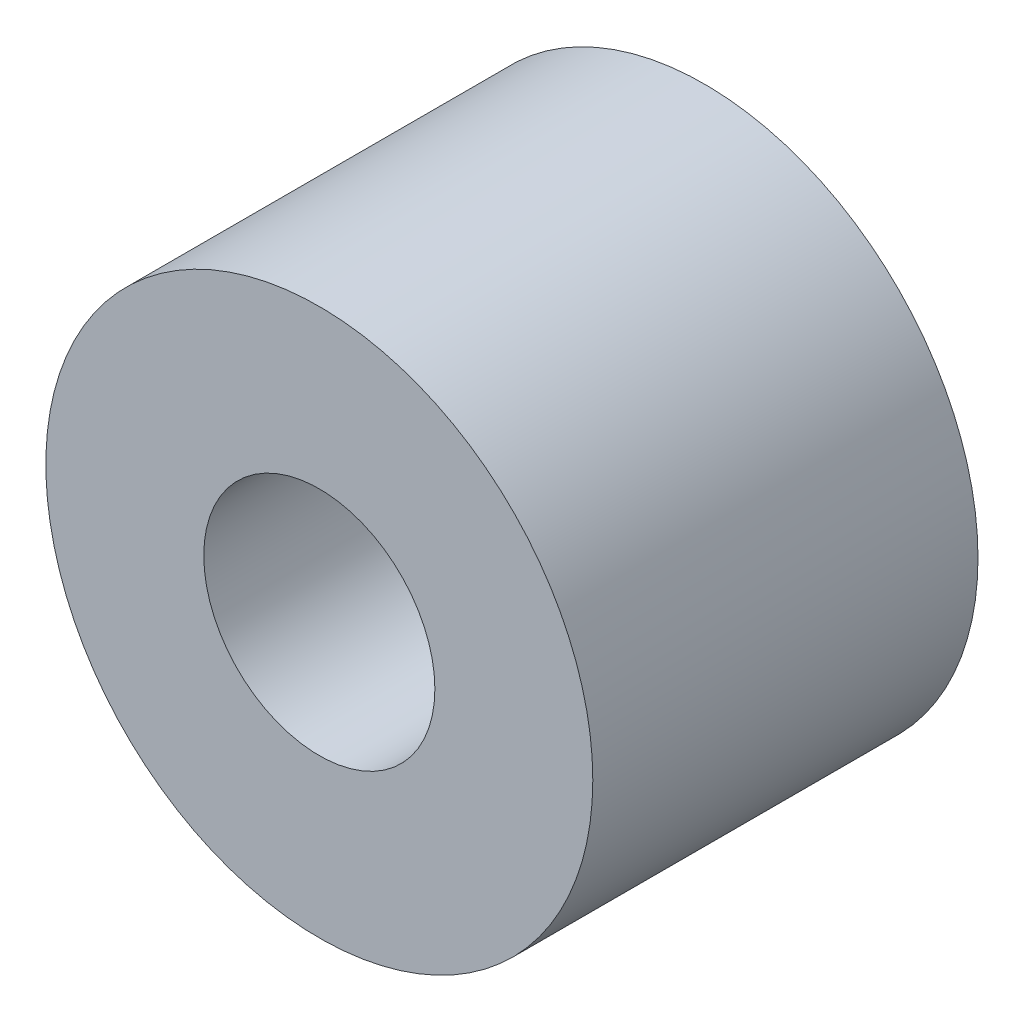
from build123d import *

# Parameters (mm, degrees)
SKETCH1_R                                      = 14.2
SKETCH1_R_2                                    = 6
CONNECTION_SPACE_ONLY_NO_THREADS_OR_SEAL_DEPTH = 20


with BuildPart() as part:
    # Sketch1 → Connection_space_only_NO_THREADS_OR_SEALS (new body)
    with BuildSketch(Plane.XY):
        Circle(SKETCH1_R)
        Circle(SKETCH1_R_2, mode=Mode.SUBTRACT)
    extrude(amount=CONNECTION_SPACE_ONLY_NO_THREADS_OR_SEAL_DEPTH)


solid = part.part
